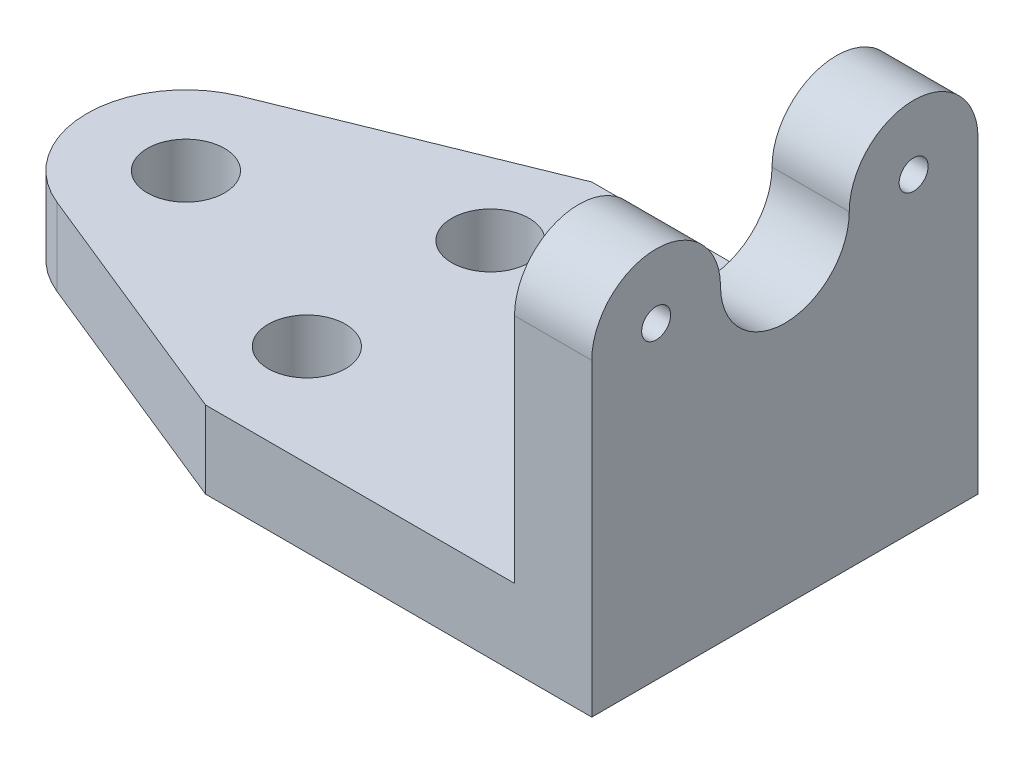
from build123d import *

# Parameters (mm, degrees)
SKETCH_2_R      = 4
EXTRUDE_1_DEPTH = 8
SKETCH_3_R      = 1.5
EXTRUDE_4_DEPTH = 8
RIB_1_REACH     = 70.036
SKETCH_9_WALL_W = 157.87192052
SKETCH_9_WALL_H = 8


with BuildPart() as part:
    # 草图2 → 凸台-拉伸1 (new body)
    with BuildSketch(Plane(origin=(0, 0, 0), x_dir=(1, 0, 0), z_dir=(0, 1, 0))):
        with BuildLine():
            Line((-20, 20), (-45.883337968, 9.505308716))
            ThreePointArc((-45.883337968, 9.505308716), (-52.286226701, 0), (-45.883337968, -9.505308716))
            Line((-45.883337968, -9.505308716), (-20, -20))
            Line((-20, -20), (20, -20))
            Line((20, -20), (20, 20))
            Line((20, 20), (-20, 20))
        make_face()
        with Locations(Location((-42.029303351, 0, 0), (0, 0, 270))):
            Circle(SKETCH_2_R, mode=Mode.SUBTRACT)
        with Locations(Location((-20, 9.505308716, 0), (0, 0, 270))):
            Circle(SKETCH_2_R, mode=Mode.SUBTRACT)
        with Locations(Location((-20, -9.505308716, 0), (0, 0, 270))):
            Circle(SKETCH_2_R, mode=Mode.SUBTRACT)
    extrude(amount=EXTRUDE_1_DEPTH)

    # 草图3 → 凸台-拉伸4 (add)
    with BuildSketch(Plane(origin=(20, 0, 0), x_dir=(0, 0, -1), z_dir=(1, 0, 0))):
        with BuildLine():
            Line((-20, 0), (20, 0))
            Line((20, 0), (20, 32))
            ThreePointArc((20, 32), (13.333333333, 38.666666667), (6.666666667, 32))
            ThreePointArc((6.666666667, 32), (0, 25.333333333), (-6.666666667, 32))
            ThreePointArc((-6.666666667, 32), (-13.333333333, 38.666666667), (-20, 32))
            Line((-20, 32), (-20, 0))
        make_face()
        with Locations((-13.333333333, 32)):
            Circle(SKETCH_3_R, mode=Mode.SUBTRACT)
        with Locations((13.333333333, 32)):
            Circle(SKETCH_3_R, mode=Mode.SUBTRACT)
    extrude(amount=-EXTRUDE_4_DEPTH)

    # 草图9 wall → 筋1 (add, up to next)
    with BuildSketch(Plane(origin=(5, 15, 0), x_dir=(0.707106781187, 0.707106781187, 0), z_dir=(-0.707106781187, 0.707106781187, 0)), mode=Mode.PRIVATE) as rib_1_sk1:
        Rectangle(SKETCH_9_WALL_W, SKETCH_9_WALL_H)
    rib_1_tool1 = extrude(rib_1_sk1.sketch, amount=-RIB_1_REACH, mode=Mode.PRIVATE) - part.part
    add(rib_1_tool1.solids().sort_by_distance((5, 15, 0))[0])


solid = part.part
